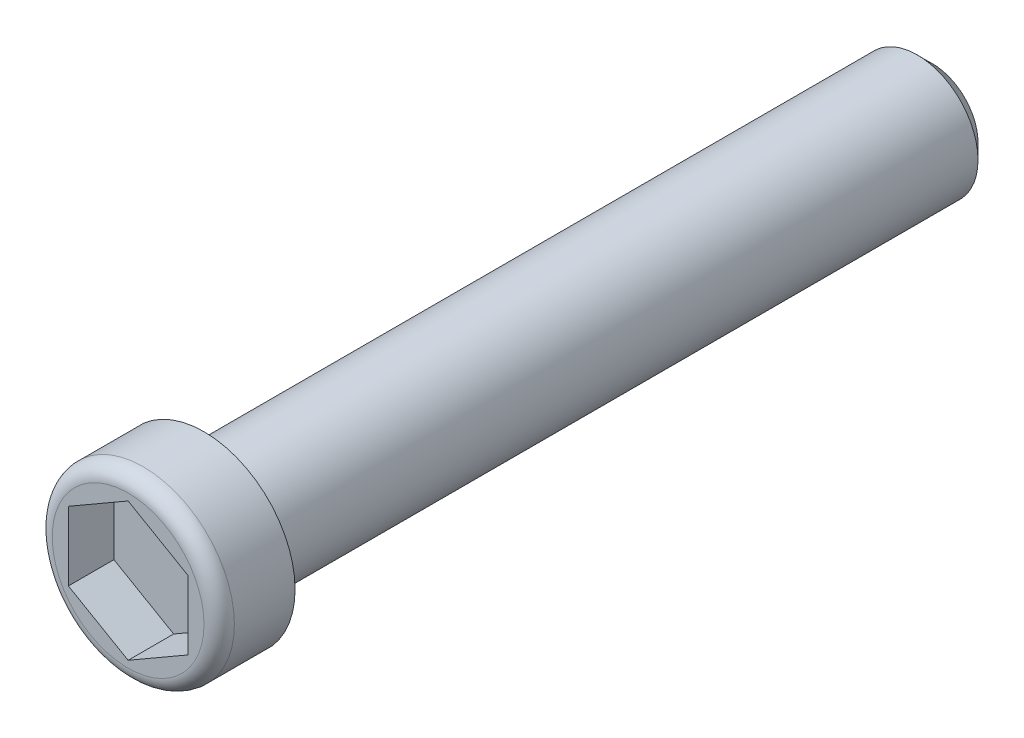
from build123d import *

# Parameters (mm, degrees)
SKETCH_1_R          = 2
EXTRUDE_1_DEPTH     = 24
SKETCH_2_R          = 3
EXTRUDE_2_DEPTH     = 2.5
CUT_EXTRUDE_1_DEPTH = 1.5
FILLET_1_R          = 0.5
CHAMFER_1_SIZE      = 0.5


with BuildPart() as part:
    # 草图1 → 凸台-拉伸1 (new body)
    with BuildSketch(Plane.XY):
        Circle(SKETCH_1_R)
    extrude(amount=EXTRUDE_1_DEPTH)

    # 草图2 → 凸台-拉伸2 (add)
    with BuildSketch(Plane.XY.offset(24)):
        Circle(SKETCH_2_R)
    extrude(amount=EXTRUDE_2_DEPTH)

    # 草图3 → 切除-拉伸1 (cut)
    with BuildSketch(Plane.XY.offset(26.5)):
        Polygon((0, 2.272766295), (-1.968273348, 1.136383147), (-1.968273348, -1.136383147), (0, -2.272766295), (1.968273348, -1.136383147), (1.968273348, 1.136383147), align=None)
    extrude(amount=-CUT_EXTRUDE_1_DEPTH, mode=Mode.SUBTRACT)

    # 圆角1
    fillet_1_edges = [part.edges().sort_by_distance(p)[0] for p in [
        (-3, 0, 26.5),
    ]]
    fillet(fillet_1_edges, radius=FILLET_1_R)

    # 倒角1
    chamfer_1_edges = [part.edges().sort_by_distance(p)[0] for p in [
        (-2, 0, 0),
    ]]
    chamfer(chamfer_1_edges, length=CHAMFER_1_SIZE)


solid = part.part
